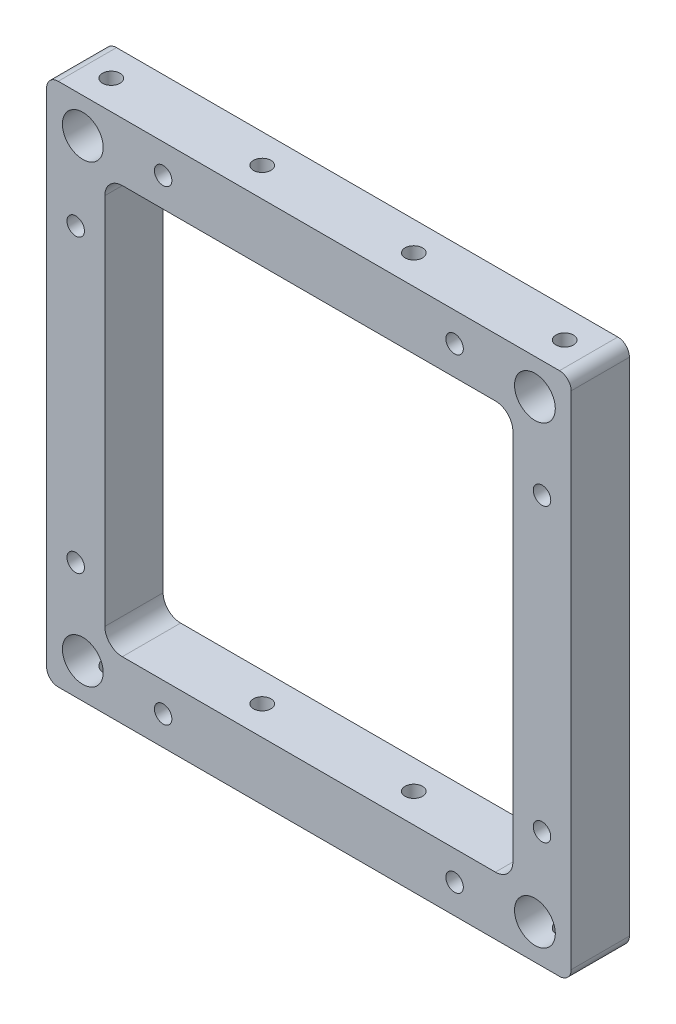
from build123d import *

# Parameters (mm, degrees)
SKETCH1_R           = 3.5
SKETCH1_W           = 70
SKETCH1_H           = 70
BOSS_EXTRUDE1_DEPTH = 10
FILLET3_R           = 2
SKETCH3_R           = 1.5
CUT_EXTRUDE2_DEPTH  = 90
CUT_EXTRUDE4_REACH  = 103.119
SKETCH5_R           = 1.5
CUT_EXTRUDE5_REACH  = 103.119
SKETCH6_R           = 1.5
FILLET5_R           = 3
CUT_EXTRUDE6_REACH  = 97.818
SKETCH7_R           = 1.5


with BuildPart() as part:
    # Sketch1 → Boss-Extrude1 (new body)
    with BuildSketch(Plane.XY):
        Polygon((45, -6), (-45, -6), (-45, 6), (-45, 72), (-45, 84), (45, 84), (45, 72), (45, 6), align=None)
        with Locations((-38.781438859, 0)):
            Circle(SKETCH1_R, mode=Mode.SUBTRACT)
        with Locations(Location((38.781438859, 0, 0), (0, 0, 180))):
            Circle(SKETCH1_R, mode=Mode.SUBTRACT)
        with Locations(Location((-38.781438859, 78, 0), (0, 0, 180))):
            Circle(SKETCH1_R, mode=Mode.SUBTRACT)
        with Locations((38.781438859, 78)):
            Circle(SKETCH1_R, mode=Mode.SUBTRACT)
        with Locations((0, 39)):
            Rectangle(SKETCH1_W, SKETCH1_H, mode=Mode.SUBTRACT)
    extrude(amount=BOSS_EXTRUDE1_DEPTH)

    # Fillet3
    fillet3_edges = [part.edges().sort_by_distance(p)[0] for p in [
        (-45, 84, 5),
        (45, 84, 5),
        (45, -6, 5),
        (-45, -6, 5),
    ]]
    fillet(fillet3_edges, radius=FILLET3_R)

    # Sketch3 → Cut-Extrude2 (cut)
    with BuildSketch(Plane.XZ.offset(6)):
        with Locations(Location((-13, 5, 0), (0, 0, 270))):
            Circle(SKETCH3_R)
        with Locations(Location((13, 5, 0), (0, 0, 270))):
            Circle(SKETCH3_R)
    extrude(amount=-CUT_EXTRUDE2_DEPTH, mode=Mode.SUBTRACT)

    # Sketch5 → Cut-Extrude4 (cut, up to next)
    with BuildSketch(Plane.XZ.offset(6), mode=Mode.PRIVATE) as cut_extrude4_sk1:
        with Locations(Location((-38.89, 5, 0), (0, 0, 270))):
            Circle(SKETCH5_R)
    cut_extrude4_tool1 = extrude(cut_extrude4_sk1.sketch, amount=-CUT_EXTRUDE4_REACH, mode=Mode.PRIVATE) & part.part
    # Sketch5 → Cut-Extrude4 (cut, up to next)
    with BuildSketch(Plane.XZ.offset(6), mode=Mode.PRIVATE) as cut_extrude4_sk2:
        with Locations(Location((38.89, 5, 0), (0, 0, 270))):
            Circle(SKETCH5_R)
    cut_extrude4_tool2 = extrude(cut_extrude4_sk2.sketch, amount=-CUT_EXTRUDE4_REACH, mode=Mode.PRIVATE) & part.part
    add(cut_extrude4_tool1.solids().sort_by_distance((-38.89, -6, 5))[0], mode=Mode.SUBTRACT)
    add(cut_extrude4_tool2.solids().sort_by_distance((38.89, -6, 5))[0], mode=Mode.SUBTRACT)

    # Sketch6 → Cut-Extrude5 (cut, up to next)
    with BuildSketch(Plane(origin=(0, 84, 0), x_dir=(1, 0, 0), z_dir=(0, 1, 0)), mode=Mode.PRIVATE) as cut_extrude5_sk1:
        with Locations(Location((-38.89, -5, 0), (0, 0, 90))):
            Circle(SKETCH6_R)
    cut_extrude5_tool1 = extrude(cut_extrude5_sk1.sketch, amount=-CUT_EXTRUDE5_REACH, mode=Mode.PRIVATE) & part.part
    # Sketch6 → Cut-Extrude5 (cut, up to next)
    with BuildSketch(Plane(origin=(0, 84, 0), x_dir=(1, 0, 0), z_dir=(0, 1, 0)), mode=Mode.PRIVATE) as cut_extrude5_sk2:
        with Locations(Location((38.89, -5, 0), (0, 0, 90))):
            Circle(SKETCH6_R)
    cut_extrude5_tool2 = extrude(cut_extrude5_sk2.sketch, amount=-CUT_EXTRUDE5_REACH, mode=Mode.PRIVATE) & part.part
    add(cut_extrude5_tool1.solids().sort_by_distance((-38.89, 84, 5))[0], mode=Mode.SUBTRACT)
    add(cut_extrude5_tool2.solids().sort_by_distance((38.89, 84, 5))[0], mode=Mode.SUBTRACT)

    # Fillet5
    fillet5_edges = [part.edges().sort_by_distance(p)[0] for p in [
        (-35, 74, 5),
        (-35, 4, 5),
        (35, 4, 5),
        (35, 74, 5),
    ]]
    fillet(fillet5_edges, radius=FILLET5_R)

    # Sketch7 → Cut-Extrude6 (cut, up to next)
    with BuildSketch(Plane.XY.offset(10), mode=Mode.PRIVATE) as cut_extrude6_sk1:
        with Locations((-25, 79)):
            Circle(SKETCH7_R)
    cut_extrude6_tool1 = extrude(cut_extrude6_sk1.sketch, amount=-CUT_EXTRUDE6_REACH, mode=Mode.PRIVATE) & part.part
    # Sketch7 → Cut-Extrude6 (cut, up to next)
    with BuildSketch(Plane.XY.offset(10), mode=Mode.PRIVATE) as cut_extrude6_sk2:
        with Locations(Location((25, 79, 0), (0, 0, 180))):
            Circle(SKETCH7_R)
    cut_extrude6_tool2 = extrude(cut_extrude6_sk2.sketch, amount=-CUT_EXTRUDE6_REACH, mode=Mode.PRIVATE) & part.part
    # Sketch7 → Cut-Extrude6 (cut, up to next)
    with BuildSketch(Plane.XY.offset(10), mode=Mode.PRIVATE) as cut_extrude6_sk3:
        with Locations((25, -1)):
            Circle(SKETCH7_R)
    cut_extrude6_tool3 = extrude(cut_extrude6_sk3.sketch, amount=-CUT_EXTRUDE6_REACH, mode=Mode.PRIVATE) & part.part
    # Sketch7 → Cut-Extrude6 (cut, up to next)
    with BuildSketch(Plane.XY.offset(10), mode=Mode.PRIVATE) as cut_extrude6_sk4:
        with Locations(Location((-25, -1, 0), (0, 0, 180))):
            Circle(SKETCH7_R)
    cut_extrude6_tool4 = extrude(cut_extrude6_sk4.sketch, amount=-CUT_EXTRUDE6_REACH, mode=Mode.PRIVATE) & part.part
    # Sketch7 → Cut-Extrude6 (cut, up to next)
    with BuildSketch(Plane.XY.offset(10), mode=Mode.PRIVATE) as cut_extrude6_sk5:
        with Locations((40, 64)):
            Circle(SKETCH7_R)
    cut_extrude6_tool5 = extrude(cut_extrude6_sk5.sketch, amount=-CUT_EXTRUDE6_REACH, mode=Mode.PRIVATE) & part.part
    # Sketch7 → Cut-Extrude6 (cut, up to next)
    with BuildSketch(Plane.XY.offset(10), mode=Mode.PRIVATE) as cut_extrude6_sk6:
        with Locations(Location((40, 14, 0), (0, 0, 180))):
            Circle(SKETCH7_R)
    cut_extrude6_tool6 = extrude(cut_extrude6_sk6.sketch, amount=-CUT_EXTRUDE6_REACH, mode=Mode.PRIVATE) & part.part
    # Sketch7 → Cut-Extrude6 (cut, up to next)
    with BuildSketch(Plane.XY.offset(10), mode=Mode.PRIVATE) as cut_extrude6_sk7:
        with Locations((-40, 14)):
            Circle(SKETCH7_R)
    cut_extrude6_tool7 = extrude(cut_extrude6_sk7.sketch, amount=-CUT_EXTRUDE6_REACH, mode=Mode.PRIVATE) & part.part
    # Sketch7 → Cut-Extrude6 (cut, up to next)
    with BuildSketch(Plane.XY.offset(10), mode=Mode.PRIVATE) as cut_extrude6_sk8:
        with Locations(Location((-40, 64, 0), (0, 0, 180))):
            Circle(SKETCH7_R)
    cut_extrude6_tool8 = extrude(cut_extrude6_sk8.sketch, amount=-CUT_EXTRUDE6_REACH, mode=Mode.PRIVATE) & part.part
    add(cut_extrude6_tool1.solids().sort_by_distance((-25, 79, 10))[0], mode=Mode.SUBTRACT)
    add(cut_extrude6_tool2.solids().sort_by_distance((25, 79, 10))[0], mode=Mode.SUBTRACT)
    add(cut_extrude6_tool3.solids().sort_by_distance((25, -1, 10))[0], mode=Mode.SUBTRACT)
    add(cut_extrude6_tool4.solids().sort_by_distance((-25, -1, 10))[0], mode=Mode.SUBTRACT)
    add(cut_extrude6_tool5.solids().sort_by_distance((40, 64, 10))[0], mode=Mode.SUBTRACT)
    add(cut_extrude6_tool6.solids().sort_by_distance((40, 14, 10))[0], mode=Mode.SUBTRACT)
    add(cut_extrude6_tool7.solids().sort_by_distance((-40, 14, 10))[0], mode=Mode.SUBTRACT)
    add(cut_extrude6_tool8.solids().sort_by_distance((-40, 64, 10))[0], mode=Mode.SUBTRACT)


solid = part.part
